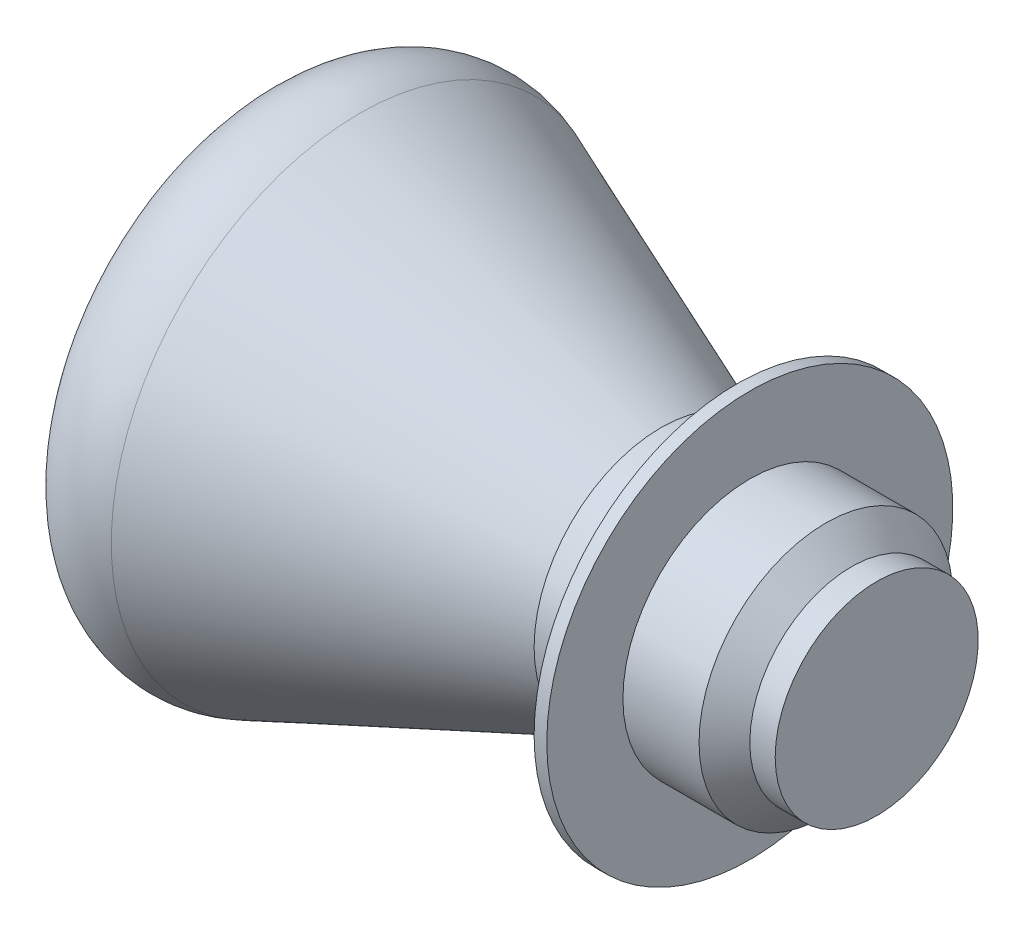
from build123d import *


with BuildPart() as part:
    # Sketch1 → Revolve1 (revolve)
    with BuildSketch(Plane.XY, mode=Mode.PRIVATE) as revolve1_sk:
        Polygon((0, 0), (5.5, 0), (5.5, 4), (4.5, 4), (3.5, 5), (0.5, 5), (0.5, 8), (0, 8), (0, 5), (-2, 5), (-2, 4.5), (0, 4.5), align=None)
    revolve(revolve1_sk.sketch.rotate(Axis((0, 0, 0), (1, 0, 0)), 90), axis=Axis((0, 0, 0), (1, 0, 0)))


with BuildPart() as body_2:
    # Sketch2 → Revolve2 (revolve)
    with BuildSketch(Plane.XY):
        with BuildLine():
            Line((0, 0), (0, 5))
            Line((0, 5), (-3, 5))
            Line((-3, 5), (-14.879552076, 9.782911506))
            ThreePointArc((-14.879552076, 9.782911506), (-17.311251394, 9.698262363), (-18.880391035, 7.838658147))
            ThreePointArc((-18.880391035, 7.838658147), (-19.717442945, 3.958988597), (-19.998336164, 0))
            Line((-19.998336164, 0), (0, 0))
        make_face()
    revolve(axis=Axis((0, 0, 0), (-1, 0, 0)))


solid = Compound([part.part, body_2.part])
